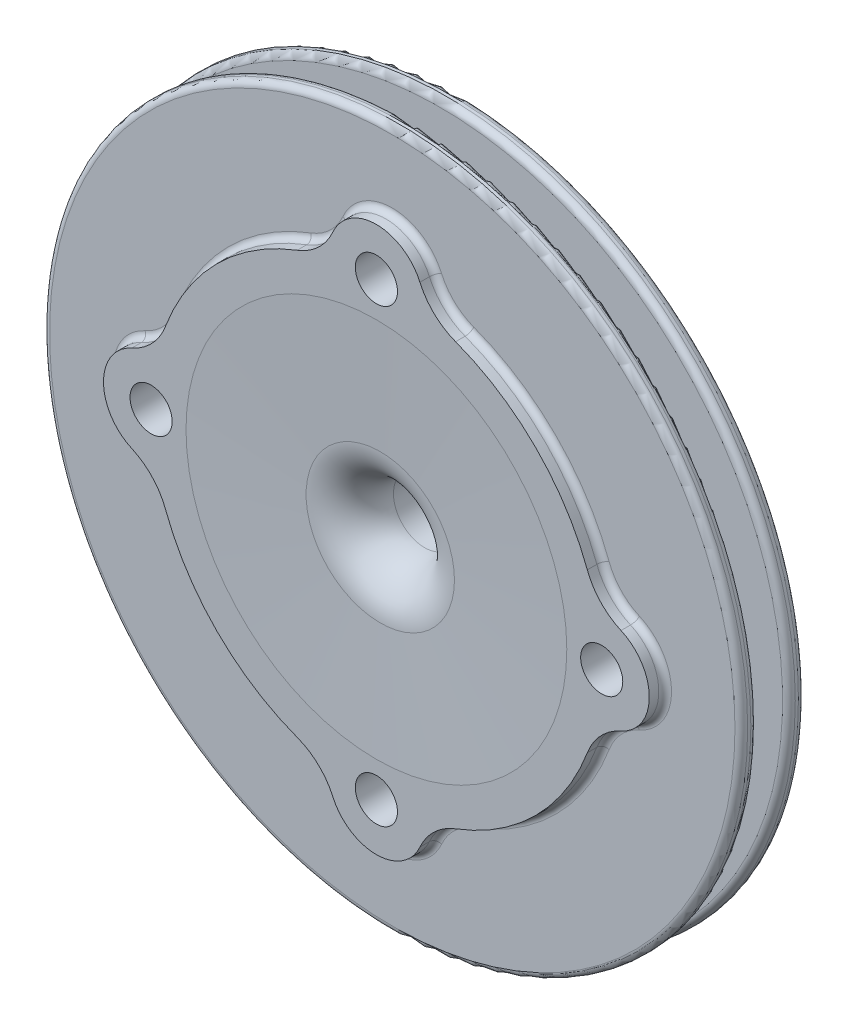
from build123d import *

# Parameters (mm, degrees)
DIAMOND_BASE_EXTRUDE_DEPTH  = 9.525
CIRCULAR_BASE_SKETCH_R      = 69.85
CIRCULAR_BASE_EXTRUDE_DEPTH = 3.175
REAR_START                  = -3.175
REAR_BASE_SKETCH_R          = 69.85
REAR_BASE_EXTRUDE_DEPTH     = 3.175
M14X1_5_CENTER_HOLE_D       = 12.5
CIRCULAR_SKETCH_R           = 4.2164
CIRCULAR_CUT_DEPTH          = 101.602919938
CIRCULAR_PATTERN_COUNT      = 4
CENTER_FILLET_R             = 8.89
PERIPHERAL_FILLET_R         = 1.27


with BuildPart() as part:
    # Diamond Base Sketch → Diamond Base Extrude (new, symmetric)
    with BuildSketch(Plane.XY):
        with BuildLine():
            ThreePointArc((-15.851278089, 42.206565934), (-31.87990923, 31.87990923), (-42.206565934, 15.851278089))
            ThreePointArc((-42.206565934, 15.851278089), (-44.858054562, 11.601200048), (-48.946745473, 8.707040077))
            ThreePointArc((-48.946745473, 8.707040077), (-54.61, 0), (-48.946745473, -8.707040077))
            ThreePointArc((-48.946745473, -8.707040077), (-44.858054562, -11.601200048), (-42.206565934, -15.851278089))
            ThreePointArc((-42.206565934, -15.851278089), (-31.87990923, -31.87990923), (-15.851278089, -42.206565934))
            ThreePointArc((-15.851278089, -42.206565934), (-11.601200048, -44.858054562), (-8.707040077, -48.946745473))
            ThreePointArc((-8.707040077, -48.946745473), (0, -54.61), (8.707040077, -48.946745473))
            ThreePointArc((8.707040077, -48.946745473), (11.601200048, -44.858054562), (15.851278089, -42.206565934))
            ThreePointArc((15.851278089, -42.206565934), (31.87990923, -31.87990923), (42.206565934, -15.851278089))
            ThreePointArc((42.206565934, -15.851278089), (44.858054562, -11.601200048), (48.946745473, -8.707040077))
            ThreePointArc((48.946745473, -8.707040077), (54.61, 0), (48.946745473, 8.707040077))
            ThreePointArc((48.946745473, 8.707040077), (44.858054562, 11.601200048), (42.206565934, 15.851278089))
            ThreePointArc((42.206565934, 15.851278089), (31.87990923, 31.87990923), (15.851278089, 42.206565934))
            ThreePointArc((15.851278089, 42.206565934), (11.601200048, 44.858054562), (8.707040077, 48.946745473))
            ThreePointArc((8.707040077, 48.946745473), (0, 54.61), (-8.707040077, 48.946745473))
            ThreePointArc((-8.707040077, 48.946745473), (-11.601200048, 44.858054562), (-15.851278089, 42.206565934))
        make_face()
    extrude(amount=DIAMOND_BASE_EXTRUDE_DEPTH, both=True)

    # Circular Base Sketch → Circular Base Extrude (add)
    with BuildSketch(Plane.XY.offset(6.35)):
        Circle(CIRCULAR_BASE_SKETCH_R)
    extrude(amount=-CIRCULAR_BASE_EXTRUDE_DEPTH)

    # Rear Base Sketch → Rear Base Extrude (add)
    with BuildSketch(Plane(origin=(0, 0, -6.35), x_dir=(-1, 0, 0), z_dir=(0, 0, -1)).offset(REAR_START)):
        with Locations(Location((0, 0, 0), (0, 0, 180))):
            Circle(REAR_BASE_SKETCH_R)
    extrude(amount=REAR_BASE_EXTRUDE_DEPTH)

    # M14x1.5 Center Hole (through all)
    with Locations(Plane.XY.offset(9.525)):
        with Locations((0, 0)):
            Hole(M14X1_5_CENTER_HOLE_D / 2)

    # Circular Sketch → Circular Cut (cut, through all)
    with BuildSketch(Plane.XY.offset(9.525)):
        with Locations((-45.085, 0)):
            Circle(CIRCULAR_SKETCH_R)
    circular_cut = extrude(amount=-CIRCULAR_CUT_DEPTH, mode=Mode.SUBTRACT)

    # Circular Pattern: Circular Cut ×4 about axis
    circular_pattern_axis = Axis((0, 0, 0), (0, 0, 1))
    for i in range(1, CIRCULAR_PATTERN_COUNT):
        add(circular_cut.rotate(circular_pattern_axis, i * 360 / CIRCULAR_PATTERN_COUNT), mode=Mode.SUBTRACT)

    # Sketch12 → Triangular Revolve Cut (revolve, cut)
    with BuildSketch(Plane(origin=(0, 0, 0), x_dir=(1, 0, 0), z_dir=(0, 1, 0))):
        Polygon((0, -8.255), (38.1, -9.525), (0, -9.525), align=None)
    revolve(axis=Axis((0, 0, 0), (0, 0, 1)), mode=Mode.SUBTRACT)

    # Center Fillet
    center_fillet_edges = [part.edges().sort_by_distance(p)[0] for p in [
        (0, -6.25, 8.463333333),
    ]]
    fillet(center_fillet_edges, radius=CENTER_FILLET_R)

    # Peripheral Fillet
    peripheral_fillet_edges = [part.edges().sort_by_distance(p)[0] for p in [
        (54.61, 0, -6.35),
        (44.858054562, -11.601200048, -6.35),
        (11.601200048, -44.858054562, -6.35),
        (0, -54.61, -6.35),
        (-11.601200048, -44.858054562, -6.35),
        (-31.87990923, -31.87990923, -6.35),
        (-44.858054562, -11.601200048, -6.35),
        (-54.61, 0, -6.35),
        (-44.858054562, 11.601200048, -6.35),
        (-31.87990923, 31.87990923, -6.35),
        (-11.601200048, 44.858054562, -6.35),
        (0, 54.61, -6.35),
        (11.601200048, 44.858054562, -6.35),
        (31.87990923, 31.87990923, -6.35),
        (44.858054562, 11.601200048, -6.35),
        (-69.85, 0, -3.175),
        (54.61, 0, -3.175),
        (44.858054562, -11.601200048, -3.175),
        (11.601200048, -44.858054562, -3.175),
        (0, -54.61, -3.175),
        (-11.601200048, -44.858054562, -3.175),
        (-31.87990923, -31.87990923, -3.175),
        (-44.858054562, -11.601200048, -3.175),
        (-54.61, 0, -3.175),
        (-44.858054562, 11.601200048, -3.175),
        (-31.87990923, 31.87990923, -3.175),
        (-11.601200048, 44.858054562, -3.175),
        (0, 54.61, -3.175),
        (11.601200048, 44.858054562, -3.175),
        (31.87990923, 31.87990923, -3.175),
        (44.858054562, 11.601200048, -3.175),
        (-69.85, 0, -6.35),
        (31.87990923, -31.87990923, 6.35),
        (31.87990923, -31.87990923, 3.175),
        (44.858054562, -11.601200048, 6.35),
        (54.61, 0, 6.35),
        (44.858054562, 11.601200048, 6.35),
        (31.87990923, 31.87990923, 6.35),
        (11.601200048, 44.858054562, 6.35),
        (0, 54.61, 6.35),
        (-11.601200048, 44.858054562, 6.35),
        (-31.87990923, 31.87990923, 6.35),
        (-44.858054562, 11.601200048, 6.35),
        (-54.61, 0, 6.35),
        (-44.858054562, -11.601200048, 6.35),
        (-31.87990923, -31.87990923, 6.35),
        (-11.601200048, -44.858054562, 6.35),
        (0, -54.61, 6.35),
        (11.601200048, -44.858054562, 6.35),
        (-69.85, 0, 3.175),
        (44.858054562, -11.601200048, 3.175),
        (54.61, 0, 3.175),
        (44.858054562, 11.601200048, 3.175),
        (31.87990923, 31.87990923, 3.175),
        (11.601200048, 44.858054562, 3.175),
        (0, 54.61, 3.175),
        (-11.601200048, 44.858054562, 3.175),
        (-31.87990923, 31.87990923, 3.175),
        (-44.858054562, 11.601200048, 3.175),
        (-54.61, 0, 3.175),
        (-44.858054562, -11.601200048, 3.175),
        (-31.87990923, -31.87990923, 3.175),
        (-11.601200048, -44.858054562, 3.175),
        (0, -54.61, 3.175),
        (11.601200048, -44.858054562, 3.175),
        (-69.85, 0, 6.35),
        (31.87990923, -31.87990923, -6.35),
        (31.87990923, -31.87990923, -3.175),
    ]]
    fillet(peripheral_fillet_edges, radius=PERIPHERAL_FILLET_R)


solid = part.part
